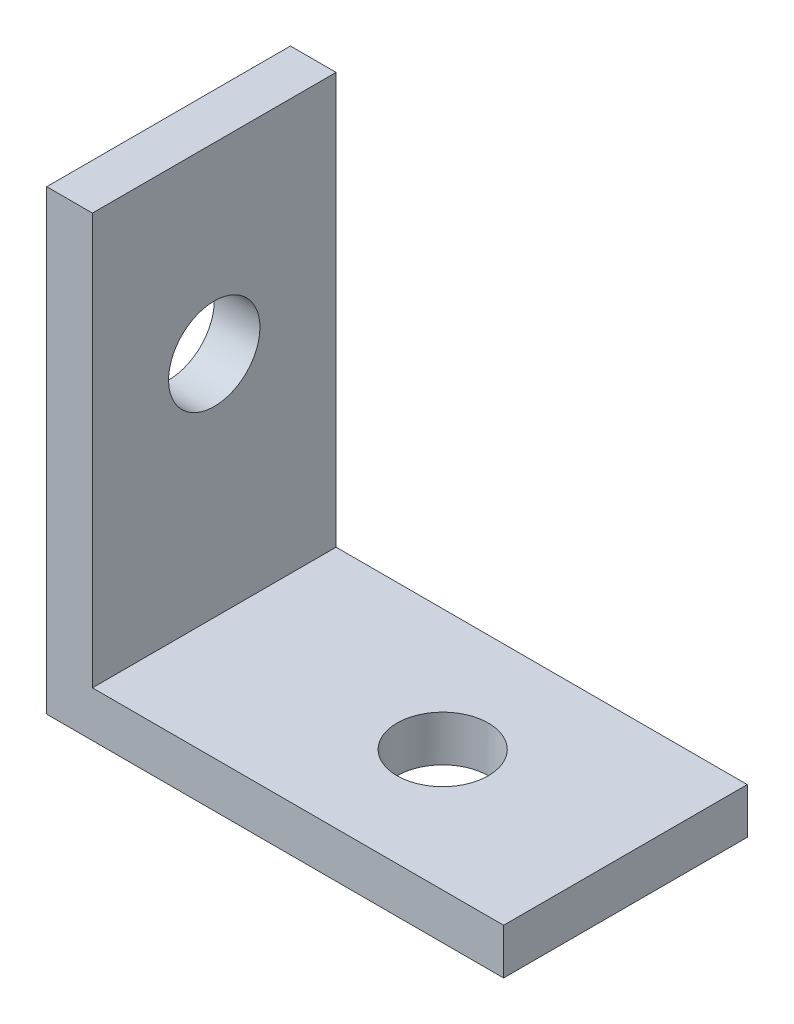
from build123d import *

# Parameters (mm, degrees)
EXTRUSION1_DEPTH = 8
ESQUISSE2_R      = 1.5
EXTRUSION2_DEPTH = 80
ESQUISSE3_R      = 1.5
EXTRUSION3_DEPTH = 80


with BuildPart() as part:
    # Esquisse1 → Extrusion1 (new body)
    with BuildSketch(Plane.XY):
        Polygon((-3.463711982, -6.095820103), (-1.963711982, -6.095820103), (-1.963711982, -19.595820103), (11.536288018, -19.595820103), (11.536288018, -21.095820103), (-3.463711982, -21.095820103), align=None)
    extrude(amount=EXTRUSION1_DEPTH)

    # Esquisse2 → Extrusion2 (cut)
    with BuildSketch(Plane(origin=(-1.963711982, 0, 0), x_dir=(0, 0, -1), z_dir=(1, 0, 0))):
        with Locations(Location((-4, -12.095820103, 0), (0, 0, 90))):
            Circle(ESQUISSE2_R)
    extrude(amount=-EXTRUSION2_DEPTH, mode=Mode.SUBTRACT)

    # Esquisse3 → Extrusion3 (cut)
    with BuildSketch(Plane(origin=(0, -19.595820103, 0), x_dir=(-1, 0, 0), z_dir=(0, 1, 0))):
        with Locations(Location((-5.536288018, 4, 0), (0, 0, 90))):
            Circle(ESQUISSE3_R)
    extrude(amount=-EXTRUSION3_DEPTH, mode=Mode.SUBTRACT)


solid = part.part
